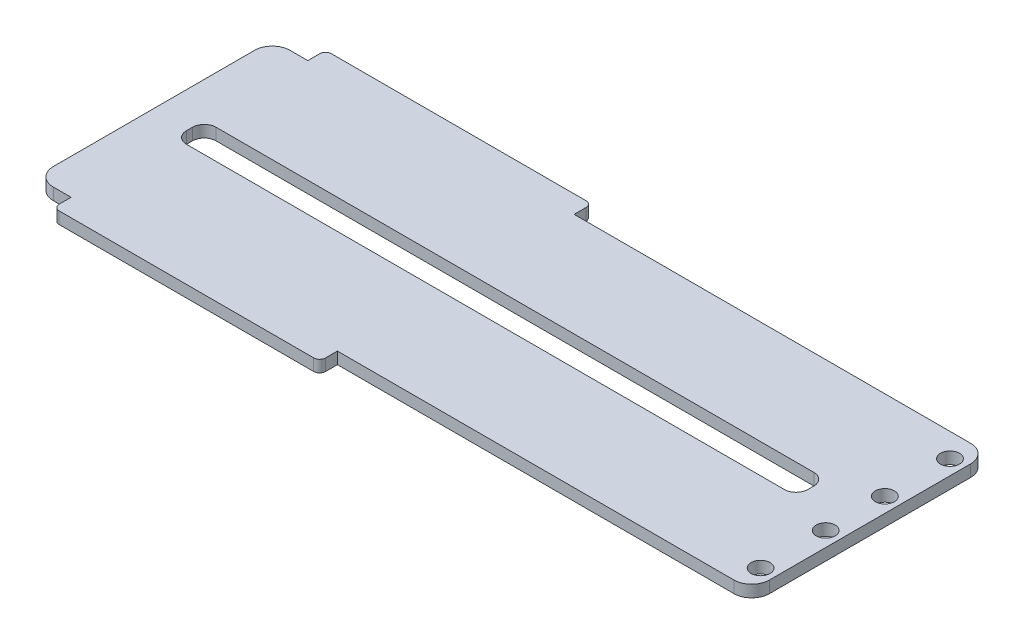
from build123d import *

# Parameters (mm, degrees)
SKETCH_1_W          = 125
SKETCH_1_H          = 40
SKETCH_1_R          = 1.6
SKETCH_1_W_2        = 45
SKETCH_1_H_2        = 3
EXTRUDE_1_DEPTH     = 2
SKETCH_2_W          = 4
SKETCH_2_H          = 40
CUT_EXTRUDE_1_DEPTH = 10
FILLET_1_R          = 3
FILLET_2_R          = 1


with BuildPart() as part:
    # 草图1 → 凸台-拉伸1 (new body)
    # profile 1 of 3: a face of its own
    with BuildSketch(Plane(origin=(0, 0, 0), x_dir=(1, 0, 0), z_dir=(0, 1, 0))):
        Rectangle(SKETCH_1_W, SKETCH_1_H)
        with Locations(Location((60, 16, 0), (0, 0, 270))):
            Circle(SKETCH_1_R, mode=Mode.SUBTRACT)
        with Locations(Location((60, 5, 0), (0, 0, 270))):
            Circle(SKETCH_1_R, mode=Mode.SUBTRACT)
        with Locations(Location((60, -5, 0), (0, 0, 270))):
            Circle(SKETCH_1_R, mode=Mode.SUBTRACT)
        with Locations(Location((60, -16, 0), (0, 0, 270))):
            Circle(SKETCH_1_R, mode=Mode.SUBTRACT)
        with BuildLine():
            Line((-50.5, -2.5), (50.5, -2.5))
            ThreePointArc((50.5, -2.5), (51.914213562, -1.914213562), (52.5, -0.5))
            Line((52.5, -0.5), (52.5, 0.5))
            ThreePointArc((52.5, 0.5), (51.914213562, 1.914213562), (50.5, 2.5))
            Line((50.5, 2.5), (-50.5, 2.5))
            ThreePointArc((-50.5, 2.5), (-51.914213562, 1.914213562), (-52.5, 0.5))
            Line((-52.5, 0.5), (-52.5, -0.5))
            ThreePointArc((-52.5, -0.5), (-51.914213562, -1.914213562), (-50.5, -2.5))
        make_face(mode=Mode.SUBTRACT)
    # profile 2 of 3: a face of its own
    with BuildSketch(Plane(origin=(0, 0, 0), x_dir=(1, 0, 0), z_dir=(0, 1, 0))):
        with Locations((-30, -21.5)):
            Rectangle(SKETCH_1_W_2, SKETCH_1_H_2)
    # profile 3 of 3: a face of its own
    with BuildSketch(Plane(origin=(0, 0, 0), x_dir=(1, 0, 0), z_dir=(0, 1, 0))):
        with Locations((-30, 21.5)):
            Rectangle(SKETCH_1_W_2, SKETCH_1_H_2)
    extrude(amount=EXTRUDE_1_DEPTH)

    # 草图2 → 切除-拉伸1 (cut)
    with BuildSketch(Plane(origin=(0, 2, 0), x_dir=(1, 0, 0), z_dir=(0, 1, 0))):
        with Locations((-60.5, 0)):
            Rectangle(SKETCH_2_W, SKETCH_2_H)
    extrude(amount=-CUT_EXTRUDE_1_DEPTH, mode=Mode.SUBTRACT)

    # 圆角1
    fillet_1_edges = [part.edges().sort_by_distance(p)[0] for p in [
        (62.5, 1, -20),
        (62.5, 1, 20),
        (-58.5, 1, -20),
        (-58.5, 1, 20),
    ]]
    fillet(fillet_1_edges, radius=FILLET_1_R)

    # 圆角2
    fillet_2_edges = [part.edges().sort_by_distance(p)[0] for p in [
        (-52.5, 1, -23),
        (-7.5, 1, -23),
        (-7.5, 1, 23),
        (-52.5, 1, 23),
    ]]
    fillet(fillet_2_edges, radius=FILLET_2_R)


solid = part.part
